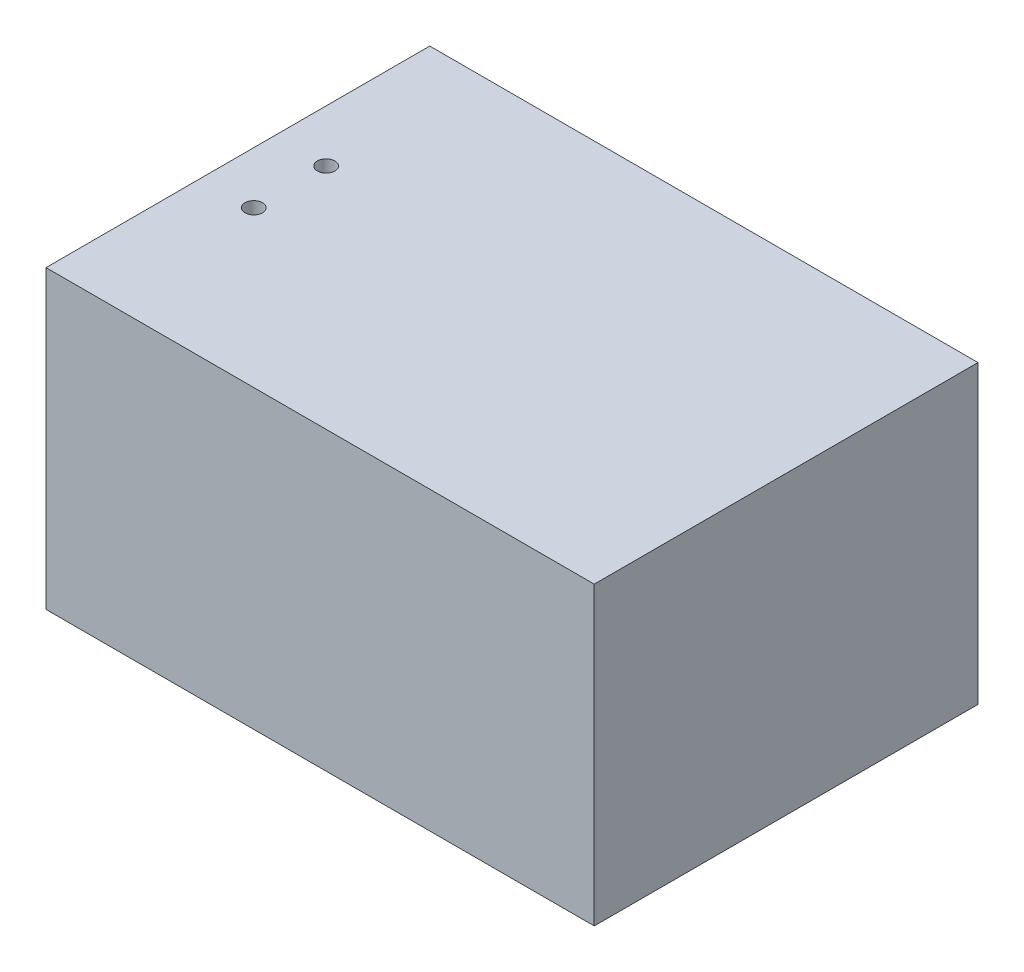
from build123d import *

# Parameters (mm, degrees)
SKIZZE1_W                       = 100
SKIZZE1_H                       = 70
AUFSATZ_LINEAR_AUSTRAGEN1_DEPTH = 4
SKIZZE2_W                       = 100
SKIZZE2_H                       = 70
SKIZZE2_R                       = 2.1
AUFSATZ_LINEAR_AUSTRAGEN2_DEPTH = 50
SKIZZE3_R                       = 2.8
SCHNITT_LINEAR_AUSTRAGEN1_DEPTH = 9
SCHNITT_LINEAR_AUSTRAGEN3_REACH = 80.899
SKIZZE5_R                       = 1.6
SKIZZE6_R                       = 2.1
SKIZZE6_W                       = 20
SKIZZE6_H                       = 15
SCHNITT_LINEAR_AUSTRAGEN4_DEPTH = 2
AUFSATZ_LINEAR_AUSTRAGEN3_DEPTH = 5
SKETCH2_R                       = 3.95
SKETCH2_R_2                     = 1.45
BOSS_EXTRUDE1_DEPTH             = 5


with BuildPart() as part:
    # Skizze1 → Aufsatz-Linear austragen1 (new body)
    with BuildSketch(Plane.XZ):
        Rectangle(SKIZZE1_W, SKIZZE1_H)
    extrude(amount=AUFSATZ_LINEAR_AUSTRAGEN1_DEPTH)

    # Skizze2 → Aufsatz-Linear austragen2 (add)
    with BuildSketch(Plane.XZ.offset(4)):
        Rectangle(SKIZZE2_W, SKIZZE2_H)
        with Locations(Location((-45, 30, 0), (0, 0, 270))):
            Circle(SKIZZE2_R, mode=Mode.SUBTRACT)
        with Locations(Location((45, 30, 0), (0, 0, 90))):
            Circle(SKIZZE2_R, mode=Mode.SUBTRACT)
        with Locations(Location((45, -30, 0), (0, 0, 270))):
            Circle(SKIZZE2_R, mode=Mode.SUBTRACT)
        with Locations(Location((-45, -30, 0), (0, 0, 90))):
            Circle(SKIZZE2_R, mode=Mode.SUBTRACT)
        with BuildLine():
            Line((-48, 24.9), (-48, -24.9))
            Line((-48, -24.9), (-45, -24.9))
            ThreePointArc((-45, -24.9), (-41.393755416, -26.393755416), (-39.9, -30))
            Line((-39.9, -30), (-39.9, -33))
            Line((-39.9, -33), (39.9, -33))
            Line((39.9, -33), (39.9, -30))
            ThreePointArc((39.9, -30), (41.393755416, -26.393755416), (45, -24.9))
            Line((45, -24.9), (48, -24.9))
            Line((48, -24.9), (48, 24.9))
            Line((48, 24.9), (45, 24.9))
            ThreePointArc((45, 24.9), (41.393755416, 26.393755416), (39.9, 30))
            Line((39.9, 30), (39.9, 33))
            Line((39.9, 33), (-39.9, 33))
            Line((-39.9, 33), (-39.9, 30))
            ThreePointArc((-39.9, 30), (-41.393755416, 26.393755416), (-45, 24.9))
            Line((-45, 24.9), (-48, 24.9))
        make_face(mode=Mode.SUBTRACT)
    extrude(amount=AUFSATZ_LINEAR_AUSTRAGEN2_DEPTH)

    # Skizze3 → Schnitt-Linear austragen1 (cut)
    with BuildSketch(Plane.XZ.offset(54)):
        with Locations(Location((-45, 30, 0), (0, 0, 270))):
            Circle(SKIZZE3_R)
        with Locations(Location((45, 30, 0), (0, 0, 90))):
            Circle(SKIZZE3_R)
        with Locations(Location((45, -30, 0), (0, 0, 270))):
            Circle(SKIZZE3_R)
        with Locations(Location((-45, -30, 0), (0, 0, 90))):
            Circle(SKIZZE3_R)
    extrude(amount=-SCHNITT_LINEAR_AUSTRAGEN1_DEPTH, mode=Mode.SUBTRACT)

    # Skizze5 → Schnitt-Linear austragen3 (cut, up to next)
    with BuildSketch(Plane.XZ.offset(4), mode=Mode.PRIVATE) as schnitt_linear_austragen3_sk1:
        with Locations(Location((-40.5, 6.6, 0), (0, 0, 270))):
            Circle(SKIZZE5_R)
    schnitt_linear_austragen3_tool1 = extrude(schnitt_linear_austragen3_sk1.sketch, amount=-SCHNITT_LINEAR_AUSTRAGEN3_REACH, mode=Mode.PRIVATE) & part.part
    # Skizze5 → Schnitt-Linear austragen3 (cut, up to next)
    with BuildSketch(Plane.XZ.offset(4), mode=Mode.PRIVATE) as schnitt_linear_austragen3_sk2:
        with Locations(Location((-40.5, -6.6, 0), (0, 0, 90))):
            Circle(SKIZZE5_R)
    schnitt_linear_austragen3_tool2 = extrude(schnitt_linear_austragen3_sk2.sketch, amount=-SCHNITT_LINEAR_AUSTRAGEN3_REACH, mode=Mode.PRIVATE) & part.part
    add(schnitt_linear_austragen3_tool1.solids().sort_by_distance((-40.5, -4, 6.6))[0], mode=Mode.SUBTRACT)
    add(schnitt_linear_austragen3_tool2.solids().sort_by_distance((-40.5, -4, -6.6))[0], mode=Mode.SUBTRACT)

    # Skizze6 → Schnitt-Linear austragen4 (cut)
    with BuildSketch(Plane(origin=(0, 0, -35), x_dir=(1, 0, 0), z_dir=(0, 0, -1))):
        with Locations(Location((-23.378367252, 30, 0), (0, 0, 270))):
            Circle(SKIZZE6_R)
        with Locations((23.378367252, 30)):
            Circle(SKIZZE6_R)
        with Locations((25.02457838, 46.5)):
            Rectangle(SKIZZE6_W, SKIZZE6_H)
    extrude(amount=-SCHNITT_LINEAR_AUSTRAGEN4_DEPTH, mode=Mode.SUBTRACT)

    # Skizze7 → Aufsatz-Linear austragen3 (add)
    # profile 1 of 2: a face of its own
    with BuildSketch(Plane.XY.offset(-33)):
        Polygon((-17.604864561, -30), (-20.491615906, -25), (-26.265118598, -25), (-29.151869944, -30), (-26.265118598, -35), (-20.491615906, -35), align=None)
        Polygon((-19.336915368, -30), (-21.35764131, -26.5), (-25.399093195, -26.5), (-27.419819137, -30), (-25.399093195, -33.5), (-21.35764131, -33.5), align=None, mode=Mode.SUBTRACT)
    # profile 2 of 2: a face of its own
    with BuildSketch(Plane.XY.offset(-33)):
        Polygon((20.491615906, -35), (17.604864561, -30), (20.491615906, -25), (26.265118598, -25), (29.151869944, -30), (26.265118598, -35), align=None)
        Polygon((21.35764131, -33.5), (19.336915368, -30), (21.35764131, -26.5), (25.399093195, -26.5), (27.419819137, -30), (25.399093195, -33.5), align=None, mode=Mode.SUBTRACT)
    extrude(amount=AUFSATZ_LINEAR_AUSTRAGEN3_DEPTH)

    # Sketch2 → Boss-Extrude1 (add)
    # profile 1 of 4: a face of its own
    with BuildSketch(Plane.XZ.offset(4)):
        with Locations(Location((-28, -12.5, 0), (0, 0, 90))):
            Circle(SKETCH2_R)
        with Locations(Location((-28, -12.5, 0), (0, 0, 270))):
            Circle(SKETCH2_R_2, mode=Mode.SUBTRACT)
    # profile 2 of 4: a face of its own
    with BuildSketch(Plane.XZ.offset(4)):
        with Locations(Location((9, -16.5, 0), (0, 0, 90))):
            Circle(SKETCH2_R)
        with Locations(Location((9, -16.5, 0), (0, 0, 270))):
            Circle(SKETCH2_R_2, mode=Mode.SUBTRACT)
    # profile 3 of 4: a face of its own
    with BuildSketch(Plane.XZ.offset(4)):
        with Locations(Location((9, 16.5, 0), (0, 0, 90))):
            Circle(SKETCH2_R)
        with Locations(Location((9, 16.5, 0), (0, 0, 90))):
            Circle(SKETCH2_R_2, mode=Mode.SUBTRACT)
    # profile 4 of 4: a face of its own
    with BuildSketch(Plane.XZ.offset(4)):
        with Locations(Location((-28, 12.5, 0), (0, 0, 90))):
            Circle(SKETCH2_R)
        with Locations(Location((-28, 12.5, 0), (0, 0, 90))):
            Circle(SKETCH2_R_2, mode=Mode.SUBTRACT)
    extrude(amount=BOSS_EXTRUDE1_DEPTH)


solid = part.part
